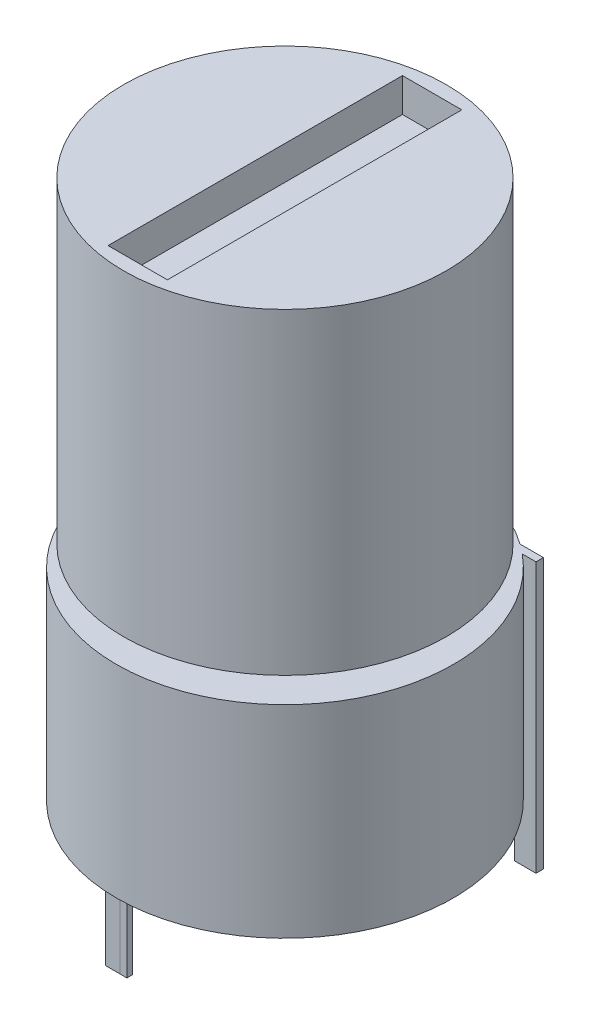
from build123d import *

# Parameters (mm, degrees)
SKETCH_1_R          = 2.5
EXTRUDE_1_DEPTH     = 3
SKETCH_2_R          = 0.187953655
EXTRUDE_2_DEPTH     = 7.3
CUT_EXTRUDE_START   = -2.3
SKETCH_4_R          = 0.187953655
CUT_EXTRUDE_1_DEPTH = 2.3
SKETCH_6_R          = 2.392138428
EXTRUDE_3_DEPTH     = 4.7
SKETCH_7_W          = 0.880091412
SKETCH_7_H          = 4.366078492
CUT_EXTRUDE_3_DEPTH = 0.5
EXTRUDE_4_DEPTH     = 1
EXTRUDE_5_DEPTH     = 4
SKETCH_11_W         = 0.290967458
SKETCH_11_H         = 0.085529097
CUT_EXTRUDE_4_DEPTH = 1


with BuildPart() as part:
    # 草图1 → 凸台-拉伸1 (new body)
    with BuildSketch(Plane(origin=(0, 0, 0), x_dir=(1, 0, 0), z_dir=(0, 1, 0))):
        with Locations(Location((0, 0, 0), (0, 0, 270))):
            Circle(SKETCH_1_R)
    extrude(amount=EXTRUDE_1_DEPTH)

    # 草图2 → 凸台-拉伸2 (add)
    with BuildSketch(Plane(origin=(0, 3, 0), x_dir=(1, 0, 0), z_dir=(0, 1, 0))):
        with Locations(Location((0, 0, 0), (0, 0, 270))):
            Circle(SKETCH_2_R)
    extrude(amount=EXTRUDE_2_DEPTH)

    # 草图4 → 切除-拉伸1 (cut)
    with BuildSketch(Plane(origin=(0, 10.3, 0), x_dir=(1, 0, 0), z_dir=(0, 1, 0)).offset(CUT_EXTRUDE_START)):
        with Locations(Location((0, 0, 0), (0, 0, 270))):
            Circle(SKETCH_4_R)
    extrude(amount=CUT_EXTRUDE_1_DEPTH, mode=Mode.SUBTRACT)

    # 草图6 → 凸台-拉伸3 (add)
    with BuildSketch(Plane(origin=(0, 8, 0), x_dir=(1, 0, 0), z_dir=(0, 1, 0))):
        with Locations(Location((0, 0, 0), (0, 0, 270))):
            Circle(SKETCH_6_R)
    extrude(amount=-EXTRUDE_3_DEPTH)

    # 草图7 → 切除-拉伸3 (cut)
    with BuildSketch(Plane(origin=(0, 8, 0), x_dir=(1, 0, 0), z_dir=(0, 1, 0))):
        Rectangle(SKETCH_7_W, SKETCH_7_H)
    extrude(amount=-CUT_EXTRUDE_3_DEPTH, mode=Mode.SUBTRACT)

    # 草图9 → 凸台-拉伸4 (add)
    with BuildSketch(Plane.XZ):
        Polygon((0, 2.448076853), (0.473512734, 2.454747582), (0.473512734, 2.362547756), (-0.506872491, 2.362547756), (-0.506872491, 2.448076853), align=None)
    extrude(amount=EXTRUDE_4_DEPTH)

    # 草图10 → 凸台-拉伸5 (add)
    with BuildSketch(Plane(origin=(0, 3, 0), x_dir=(1, 0, 0), z_dir=(0, 1, 0))):
        Polygon((-1.457651402, 1.928637822), (-1.767058539, 1.928637822), (-1.767058539, 2.038649249), (-1.447034637, 2.038649249), align=None)
        Polygon((1.478278545, 1.928637822), (1.447034637, 2.038649249), (1.794561396, 2.038649249), (1.794561396, 1.928637822), align=None)
    extrude(amount=-EXTRUDE_5_DEPTH)

    # 草图11 → 切除-拉伸4 (cut)
    with BuildSketch(Plane.XZ.offset(1)):
        with Locations((-0.361388762, 2.405312305)):
            Rectangle(SKETCH_11_W, SKETCH_11_H)
        Polygon((0.105106814, 2.449557571), (0.105106814, 2.362547756), (0.473512734, 2.362547756), (0.473512734, 2.454747582), align=None)
    extrude(amount=-CUT_EXTRUDE_4_DEPTH, mode=Mode.SUBTRACT)


solid = part.part
